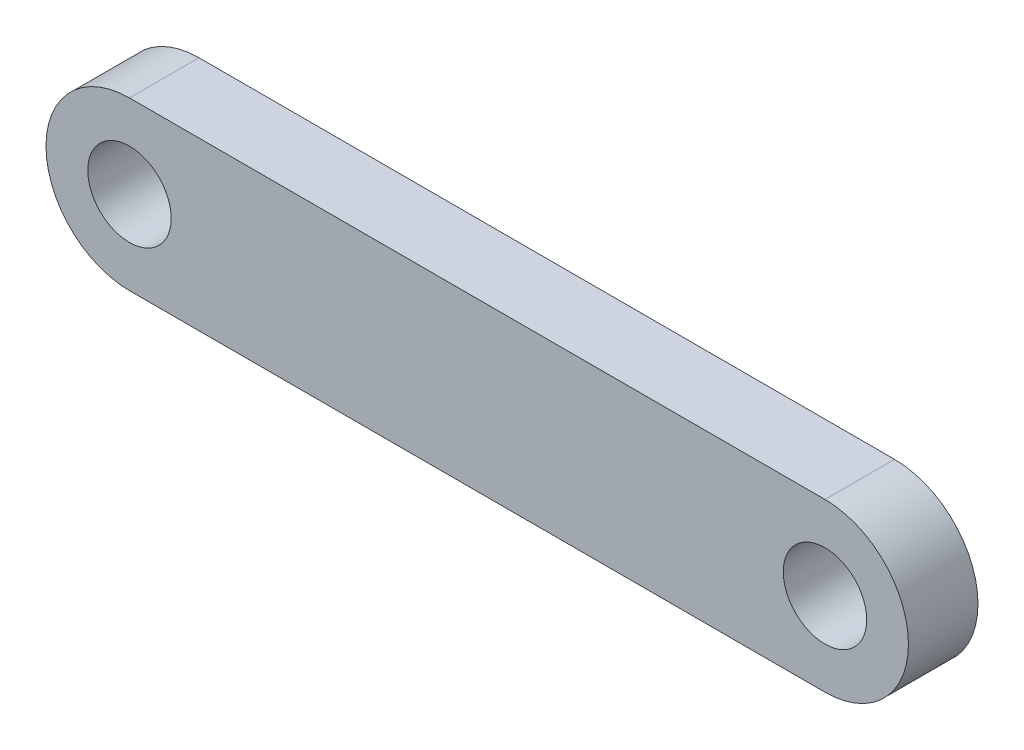
from build123d import *

# Parameters (mm, degrees)
SKETCH1_R           = 3
BOSS_EXTRUDE1_DEPTH = 2.5


with BuildPart() as part:
    # Sketch1 → Boss-Extrude1 (new, symmetric)
    with BuildSketch(Plane.XY):
        with BuildLine():
            Line((-25, 6), (25, 6))
            ThreePointArc((25, 6), (31, 0), (25, -6))
            Line((25, -6), (-25, -6))
            ThreePointArc((-25, -6), (-31, 0), (-25, 6))
        make_face()
        with Locations((-25, 0)):
            Circle(SKETCH1_R, mode=Mode.SUBTRACT)
        with Locations((25, 0)):
            Circle(SKETCH1_R, mode=Mode.SUBTRACT)
    extrude(amount=BOSS_EXTRUDE1_DEPTH, both=True)


solid = part.part
